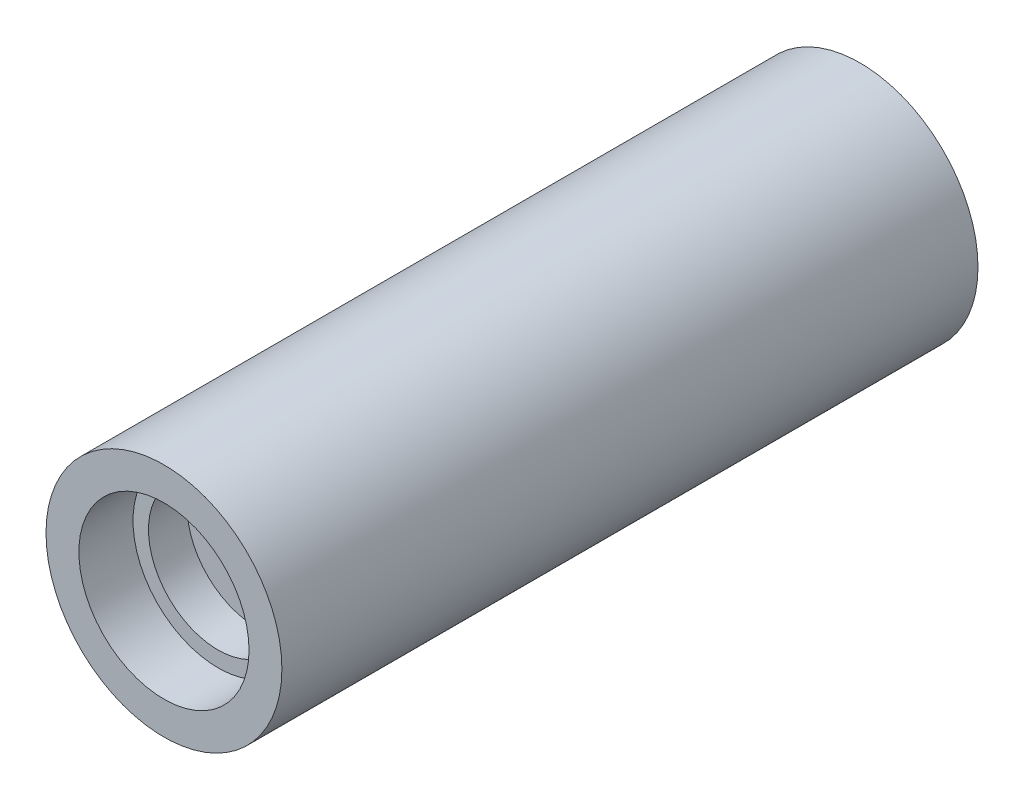
from build123d import *

# Parameters (mm, degrees)
ESQUISSE1_R             = 15.25
BOSS_EXTRU_1_DEPTH      = 90
ESQUISSE2_R             = 11
ENL_V_MAT_EXTRU_1_DEPTH = 7
ESQUISSE3_R             = 9
ENL_V_MAT_EXTRU_2_DEPTH = 5


with BuildPart() as part:
    # Esquisse1 → Boss.-Extru.1 (new body)
    with BuildSketch(Plane.XY):
        with Locations(Location((0, 0, 0), (0, 0, 180))):
            Circle(ESQUISSE1_R)
    extrude(amount=BOSS_EXTRU_1_DEPTH)

    # Esquisse2 → Enlèv. mat.-Extru.1 (cut)
    with BuildSketch(Plane.XY.offset(90)):
        Circle(ESQUISSE2_R)
    enl_v_mat_extru_1 = extrude(amount=-ENL_V_MAT_EXTRU_1_DEPTH, mode=Mode.SUBTRACT)

    # Esquisse3 → Enlèv. mat.-Extru.2 (cut)
    with BuildSketch(Plane.XY.offset(83)):
        Circle(ESQUISSE3_R)
    enl_v_mat_extru_2 = extrude(amount=-ENL_V_MAT_EXTRU_2_DEPTH, mode=Mode.SUBTRACT)

    # Symétrie1: Enlèv. mat.-Extru.1, Enlèv. mat.-Extru.2 across plane
    add(enl_v_mat_extru_1.mirror(Plane.XY.offset(45)), mode=Mode.SUBTRACT)
    add(enl_v_mat_extru_2.mirror(Plane.XY.offset(45)), mode=Mode.SUBTRACT)


solid = part.part
